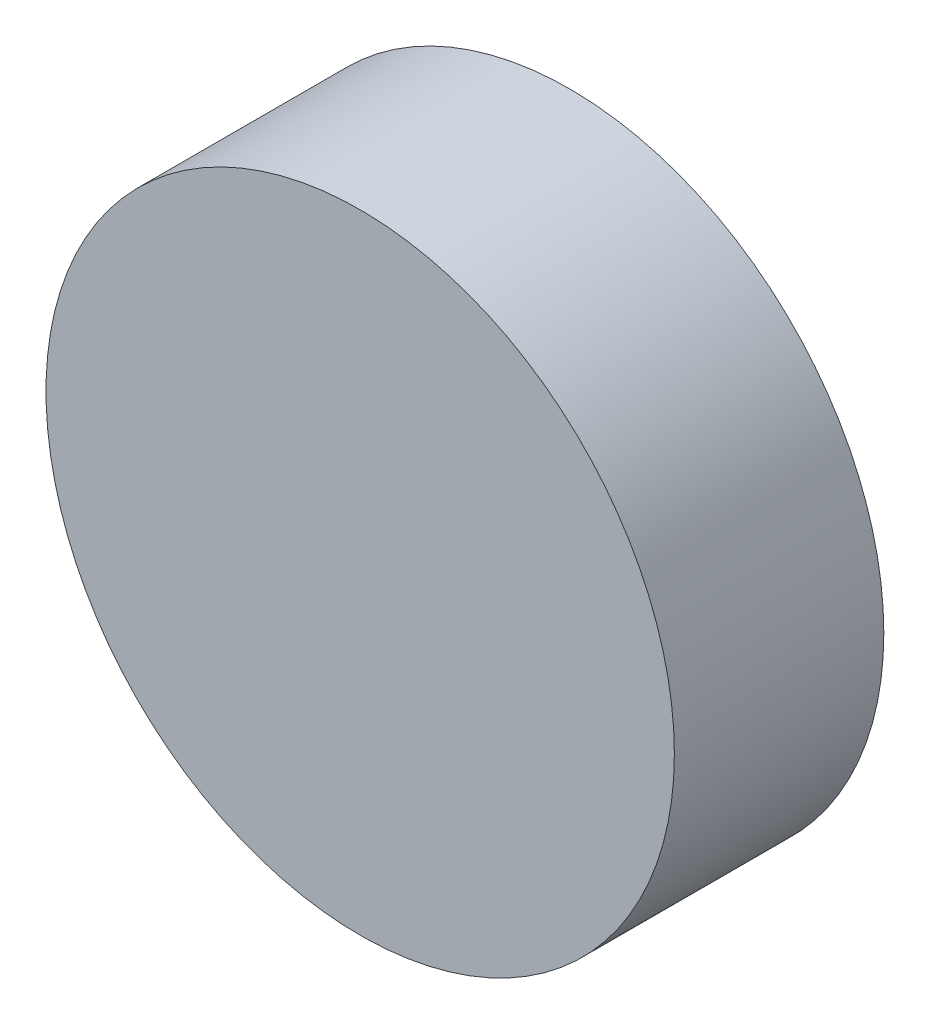
from build123d import *

# Parameters (mm, degrees)
SKETCH1_R           = 1.5
BOSS_EXTRUDE1_DEPTH = 1


with BuildPart() as part:
    # Sketch1 → Boss-Extrude1 (new body)
    with BuildSketch(Plane.XY):
        Circle(SKETCH1_R)
    extrude(amount=BOSS_EXTRUDE1_DEPTH)


solid = part.part
